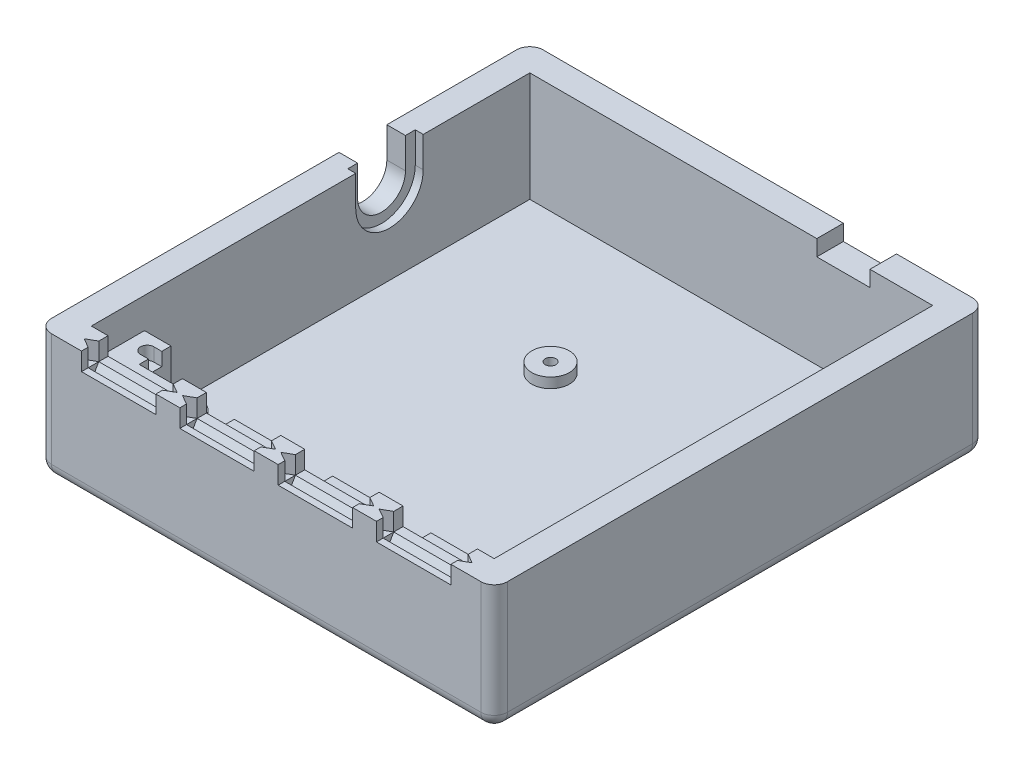
from build123d import *

# Parameters (mm, degrees)
SKETCH1_W           = 85.8
SKETCH1_H           = 92.5
BOSS_EXTRUDE1_DEPTH = 14.859
SKETCH2_W           = 85.8
SKETCH2_H           = 92.5
SKETCH2_R           = 1
BOSS_EXTRUDE2_DEPTH = 3.175
SKETCH4_W           = 85.8
SKETCH4_H           = 92.5
SKETCH4_W_2         = 75.8
SKETCH4_H_2         = 82.5
BOSS_EXTRUDE3_DEPTH = 5.75
CUT_EXTRUDE1_DEPTH  = 121.870264668
SKETCH5_W           = 14
SKETCH5_H           = 8
CUT_EXTRUDE2_DEPTH  = 121.870264668
SKETCH6_W           = 10
SKETCH6_H           = 6
CUT_EXTRUDE3_DEPTH  = 121.870264668
BOSS_EXTRUDE4_START = 1.9
SKETCH7_R           = 3.54
SKETCH7_R_2         = 1
BOSS_EXTRUDE4_DEPTH = 1.9
FILLET1_R           = 2.5
FILLET2_R           = 2.5
FILLET3_R           = 2.5
FILLET4_R           = 2.5
FILLET5_R           = 2.5
CUT_EXTRUDE4_DEPTH  = 1.5
CUT_EXTRUDE5_DEPTH  = 4
CUT_EXTRUDE7_DEPTH  = 73.9
SKETCH12_W          = 4.501
SKETCH12_H          = 4
BOSS_EXTRUDE8_DEPTH = 5
CUT_EXTRUDE8_DEPTH  = 2.5


with BuildPart() as part:
    # Sketch1 → Boss-Extrude1 (new body)
    with BuildSketch(Plane(origin=(0, 0, 0), x_dir=(1, 0, 0), z_dir=(0, 1, 0))):
        with Locations((37.9, 41.25)):
            Rectangle(SKETCH1_W, SKETCH1_H)
        Polygon((5, 4), (5, 10), (0, 10), (0, 82.5), (70.8, 82.5), (70.8, 79), (75.8, 79), (75.8, 4), (59.9, 4), (59.9, 0), (52.9, 0), (52.9, 4), (41.4, 4), (41.4, 0), (34.4, 0), (34.4, 4), (22.9, 4), (22.9, 0), (15.9, 0), (15.9, 4), align=None, mode=Mode.SUBTRACT)
    extrude(amount=BOSS_EXTRUDE1_DEPTH)

    # Sketch2 → Boss-Extrude2 (add)
    with BuildSketch(Plane(origin=(0, 0, 0), x_dir=(1, 0, 0), z_dir=(0, 1, 0))):
        with Locations((37.9, 41.25)):
            Rectangle(SKETCH2_W, SKETCH2_H)
        with Locations(Location((3.5, 13.5, 0), (0, 0, 270))):
            Circle(SKETCH2_R, mode=Mode.SUBTRACT)
        with Locations(Location((19.4, 3.5, 0), (0, 0, 270))):
            Circle(SKETCH2_R, mode=Mode.SUBTRACT)
        with Locations(Location((37.9, 3.5, 0), (0, 0, 270))):
            Circle(SKETCH2_R, mode=Mode.SUBTRACT)
        with Locations(Location((56.4, 3.5, 0), (0, 0, 270))):
            Circle(SKETCH2_R, mode=Mode.SUBTRACT)
        with Locations(Location((30.3, 56.1, 0), (0, 0, 270))):
            Circle(SKETCH2_R, mode=Mode.SUBTRACT)
        with Locations(Location((71.8, 75.5, 0), (0, 0, 270))):
            Circle(SKETCH2_R, mode=Mode.SUBTRACT)
    extrude(amount=-BOSS_EXTRUDE2_DEPTH)

    # Sketch4 → Boss-Extrude3 (add)
    with BuildSketch(Plane(origin=(0, 14.859, 0), x_dir=(1, 0, 0), z_dir=(0, 1, 0))):
        with Locations((37.9, 41.25)):
            Rectangle(SKETCH4_W, SKETCH4_H)
        with Locations((37.9, 41.25)):
            Rectangle(SKETCH4_W_2, SKETCH4_H_2, mode=Mode.SUBTRACT)
    extrude(amount=BOSS_EXTRUDE3_DEPTH)

    # Sketch3 → Cut-Extrude1 (cut, through all)
    with BuildSketch(Plane(origin=(0, 0, 0), x_dir=(0, 0, -1), z_dir=(1, 0, 0))):
        with BuildLine():
            Line((60.6, 14.859), (60.6, 20.609))
            Line((60.6, 20.609), (51.6, 20.609))
            Line((51.6, 20.609), (51.6, 14.859))
            ThreePointArc((51.6, 14.859), (56.1, 10.359), (60.6, 14.859))
        make_face()
    extrude(amount=-CUT_EXTRUDE1_DEPTH, mode=Mode.SUBTRACT)

    # Sketch5 → Cut-Extrude2 (cut, through all)
    with BuildSketch(Plane.XY):
        with Locations((10.15, 21.25)):
            Rectangle(SKETCH5_W, SKETCH5_H)
        with Locations((28.65, 21.25)):
            Rectangle(SKETCH5_W, SKETCH5_H)
        with Locations((47.15, 21.25)):
            Rectangle(SKETCH5_W, SKETCH5_H)
        with Locations((65.65, 21.25)):
            Rectangle(SKETCH5_W, SKETCH5_H)
    extrude(amount=CUT_EXTRUDE2_DEPTH, mode=Mode.SUBTRACT)

    # Sketch6 → Cut-Extrude3 (cut, through all)
    with BuildSketch(Plane.XY):
        with Locations((59, 20.63)):
            Rectangle(SKETCH6_W, SKETCH6_H)
    extrude(amount=-CUT_EXTRUDE3_DEPTH, mode=Mode.SUBTRACT)

    # Sketch7 → Boss-Extrude4 (add)
    # profile 1 of 6: a face of its own
    with BuildSketch(Plane(origin=(0, 0, 0), x_dir=(1, 0, 0), z_dir=(0, 1, 0)).offset(BOSS_EXTRUDE4_START)):
        with Locations(Location((30.3, 56.1, 0), (0, 0, 90))):
            Circle(SKETCH7_R)
        with Locations(Location((30.3, 56.1, 0), (0, 0, 270))):
            Circle(SKETCH7_R_2, mode=Mode.SUBTRACT)
    # profile 2 of 6: a face of its own
    with BuildSketch(Plane(origin=(0, 0, 0), x_dir=(1, 0, 0), z_dir=(0, 1, 0)).offset(BOSS_EXTRUDE4_START)):
        with BuildLine():
            Line((0, 13.5), (0, 10))
            Line((0, 10), (3.5, 10))
            ThreePointArc((3.5, 10), (5.974873734, 15.974873734), (0, 13.5))
        make_face()
        with Locations(Location((3.5, 13.5, 0), (0, 0, 270))):
            Circle(SKETCH7_R_2, mode=Mode.SUBTRACT)
    # profile 3 of 6: a face of its own
    with BuildSketch(Plane(origin=(0, 0, 0), x_dir=(1, 0, 0), z_dir=(0, 1, 0)).offset(BOSS_EXTRUDE4_START)):
        with BuildLine():
            Line((15.9, 3.5), (15.9, 0))
            Line((15.9, 0), (22.9, 0))
            Line((22.9, 0), (22.9, 3.5))
            ThreePointArc((22.9, 3.5), (19.4, 7), (15.9, 3.5))
        make_face()
        with Locations(Location((19.4, 3.5, 0), (0, 0, 270))):
            Circle(SKETCH7_R_2, mode=Mode.SUBTRACT)
    # profile 4 of 6: a face of its own
    with BuildSketch(Plane(origin=(0, 0, 0), x_dir=(1, 0, 0), z_dir=(0, 1, 0)).offset(BOSS_EXTRUDE4_START)):
        with BuildLine():
            Line((34.4, 3.5), (34.4, 0))
            Line((34.4, 0), (41.4, 0))
            Line((41.4, 0), (41.4, 3.5))
            ThreePointArc((41.4, 3.5), (37.9, 7), (34.4, 3.5))
        make_face()
        with Locations(Location((37.9, 3.5, 0), (0, 0, 270))):
            Circle(SKETCH7_R_2, mode=Mode.SUBTRACT)
    # profile 5 of 6: a face of its own
    with BuildSketch(Plane(origin=(0, 0, 0), x_dir=(1, 0, 0), z_dir=(0, 1, 0)).offset(BOSS_EXTRUDE4_START)):
        with BuildLine():
            Line((52.9, 3.5), (52.9, 0))
            Line((52.9, 0), (59.9, 0))
            Line((59.9, 0), (59.9, 3.5))
            ThreePointArc((59.9, 3.5), (56.4, 7), (52.9, 3.5))
        make_face()
        with Locations(Location((56.4, 3.5, 0), (0, 0, 270))):
            Circle(SKETCH7_R_2, mode=Mode.SUBTRACT)
    # profile 6 of 6: a face of its own
    with BuildSketch(Plane(origin=(0, 0, 0), x_dir=(1, 0, 0), z_dir=(0, 1, 0)).offset(BOSS_EXTRUDE4_START)):
        with BuildLine():
            Line((75.8, 79), (69.863508327, 79))
            ThreePointArc((69.863508327, 79), (69.768493994, 72.054280431), (75.8, 75.5))
            Line((75.8, 75.5), (75.8, 79))
        make_face()
        with Locations(Location((71.8, 75.5, 0), (0, 0, 270))):
            Circle(SKETCH7_R_2, mode=Mode.SUBTRACT)
    extrude(amount=-BOSS_EXTRUDE4_DEPTH)

    # Fillet1
    fillet1_edges = [part.edges().sort_by_distance(p)[0] for p in [
        (-5, 8.717, 5),
    ]]
    fillet(fillet1_edges, radius=FILLET1_R)

    # Fillet2
    fillet2_edges = [part.edges().sort_by_distance(p)[0] for p in [
        (80.8, 8.717, 5),
    ]]
    fillet(fillet2_edges, radius=FILLET2_R)

    # Fillet3
    fillet3_edges = [part.edges().sort_by_distance(p)[0] for p in [
        (80.8, 8.717, -87.5),
    ]]
    fillet(fillet3_edges, radius=FILLET3_R)

    # Fillet4
    fillet4_edges = [part.edges().sort_by_distance(p)[0] for p in [
        (-5, 8.717, -87.5),
    ]]
    fillet(fillet4_edges, radius=FILLET4_R)

    # Fillet5
    fillet5_edges = [part.edges().sort_by_distance(p)[0] for p in [
        (37.9, -3.175, 5),
        (-4.267766953, -3.175, 4.267766953),
        (80.8, -3.175, -41.25),
        (80.067766953, -3.175, 4.267766953),
        (37.9, -3.175, -87.5),
        (80.067766953, -3.175, -86.767766953),
        (-5, -3.175, -41.25),
        (-4.267766953, -3.175, -86.767766953),
    ]]
    fillet(fillet5_edges, radius=FILLET5_R)

    # Sketch8 → Cut-Extrude4 (cut)
    with BuildSketch(Plane(origin=(0, 0, 0), x_dir=(0, 0, -1), z_dir=(1, 0, 0))):
        with BuildLine():
            Line((62.45, 14.855), (62.45, 21.205))
            Line((62.45, 21.205), (49.75, 21.205))
            Line((49.75, 21.205), (49.75, 14.855))
            ThreePointArc((49.75, 14.855), (56.1, 8.505), (62.45, 14.855))
        make_face()
    extrude(amount=-CUT_EXTRUDE4_DEPTH, mode=Mode.SUBTRACT)

    # Sketch9 → Cut-Extrude5 (cut)
    with BuildSketch(Plane(origin=(0, 20.609, 0), x_dir=(1, 0, 0), z_dir=(0, 1, 0))):
        Polygon((3.15, -1.75), (3.15, -3.75), (1.4, -2.75), align=None)
        Polygon((17.15, -1.75), (17.15, -3.75), (18.9, -2.75), align=None)
        Polygon((21.65, -1.75), (21.65, -3.75), (19.9, -2.75), align=None)
        Polygon((35.65, -1.75), (37.4, -2.75), (35.65, -3.75), align=None)
        Polygon((40.15, -1.75), (38.4, -2.75), (40.15, -3.75), align=None)
        Polygon((54.15, -1.75), (54.15, -3.75), (55.9, -2.75), align=None)
        Polygon((58.65, -1.75), (58.65, -3.75), (56.9, -2.75), align=None)
        Polygon((72.65, -1.75), (72.65, -3.75), (74.4, -2.75), align=None)
    extrude(amount=-CUT_EXTRUDE5_DEPTH, mode=Mode.SUBTRACT)

    # Sketch10 → Cut-Extrude7 (cut)
    with BuildSketch(Plane(origin=(0, 0, 0), x_dir=(0, 0, -1), z_dir=(1, 0, 0))):
        Polygon((-3.75, 17.25), (-1.75, 17.25), (-2.75, 15.5), align=None)
    extrude(amount=CUT_EXTRUDE7_DEPTH, mode=Mode.SUBTRACT)

    # Sketch12 → Boss-Extrude8 (add)
    with BuildSketch(Plane.XY):
        with Locations((0.8995, 15.25)):
            Rectangle(SKETCH12_W, SKETCH12_H)
        with Locations((19.3995, 15.25)):
            Rectangle(SKETCH12_W, SKETCH12_H)
        with Locations((37.8995, 15.25)):
            Rectangle(SKETCH12_W, SKETCH12_H)
        with Locations((56.3995, 15.25)):
            Rectangle(SKETCH12_W, SKETCH12_H)
        with Locations((74.9005, 15.25)):
            Rectangle(SKETCH12_W, SKETCH12_H)
    extrude(amount=BOSS_EXTRUDE8_DEPTH)

    # Sketch13 → Cut-Extrude8 (cut)
    with BuildSketch(Plane(origin=(0, 14.859, 0), x_dir=(1, 0, 0), z_dir=(0, 1, 0))):
        with BuildLine():
            Line((3.5, 8.25), (5, 8.25))
            Line((5, 8.25), (5, 5.75))
            Line((5, 5.75), (3.5, 5.75))
            ThreePointArc((3.5, 5.75), (2.25, 7), (3.5, 8.25))
        make_face()
    extrude(amount=-CUT_EXTRUDE8_DEPTH, mode=Mode.SUBTRACT)


solid = part.part
